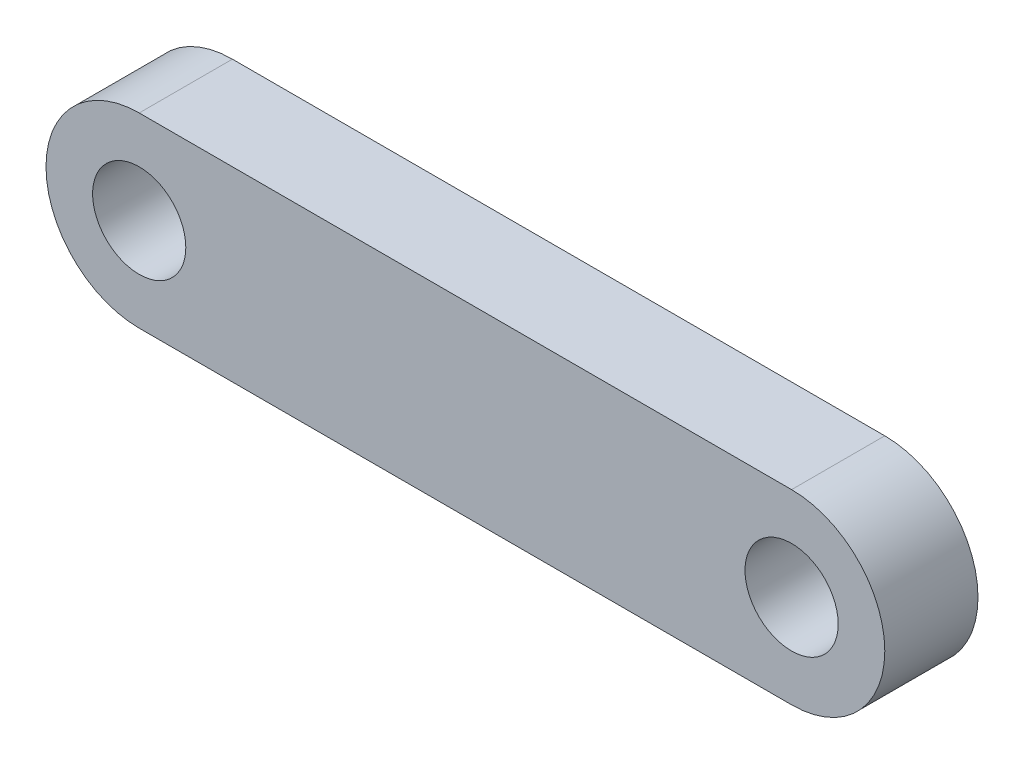
from build123d import *

# Parameters (mm, degrees)
SKETCH_1_R      = 25
EXTRUDE_1_DEPTH = 50


with BuildPart() as part:
    # 草图1 → 拉伸1 (new body)
    with BuildSketch(Plane.XY):
        with BuildLine():
            Line((0, 50), (350, 50))
            ThreePointArc((350, 50), (400, 0), (350, -50))
            Line((350, -50), (0, -50))
            ThreePointArc((0, -50), (-50, 0), (0, 50))
        make_face()
        Circle(SKETCH_1_R, mode=Mode.SUBTRACT)
        with Locations((350, 0)):
            Circle(SKETCH_1_R, mode=Mode.SUBTRACT)
    extrude(amount=EXTRUDE_1_DEPTH)


solid = part.part
